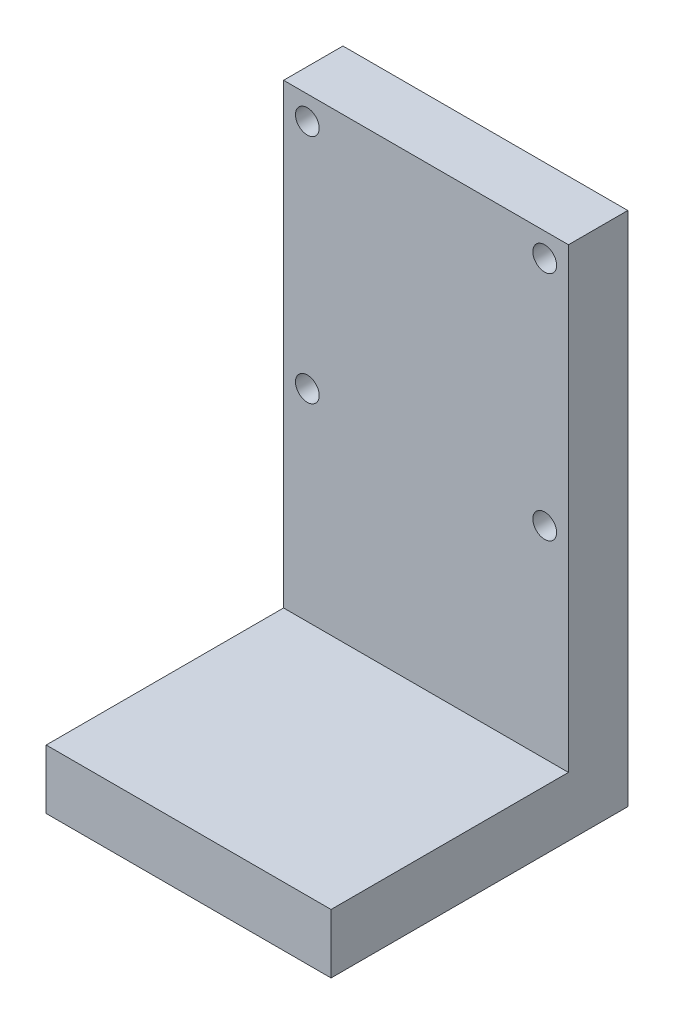
from build123d import *

# Parameters (mm, degrees)
SKETCH3_W           = 48
SKETCH3_H           = 87
SKETCH3_R           = 2
BOSS_EXTRUDE1_DEPTH = 10
SKETCH3_3_W         = 48
SKETCH3_3_H         = 10
BOSS_EXTRUDE2_DEPTH = 50


with BuildPart() as part:
    # Sketch3 → Boss-Extrude1 (new body)
    with BuildSketch(Plane.XY):
        with Locations((0, -20)):
            Rectangle(SKETCH3_W, SKETCH3_H)
        with Locations((20, 19.5)):
            Circle(SKETCH3_R, mode=Mode.SUBTRACT)
        with Locations((-20, -19.5)):
            Circle(SKETCH3_R, mode=Mode.SUBTRACT)
        with Locations((-20, 19.5)):
            Circle(SKETCH3_R, mode=Mode.SUBTRACT)
        with Locations((20, -19.5)):
            Circle(SKETCH3_R, mode=Mode.SUBTRACT)
    extrude(amount=BOSS_EXTRUDE1_DEPTH)

    # Sketch3<3> → Boss-Extrude2 (add)
    with BuildSketch(Plane.XY):
        with Locations((0, -58.5)):
            Rectangle(SKETCH3_3_W, SKETCH3_3_H)
    extrude(amount=BOSS_EXTRUDE2_DEPTH)


solid = part.part
